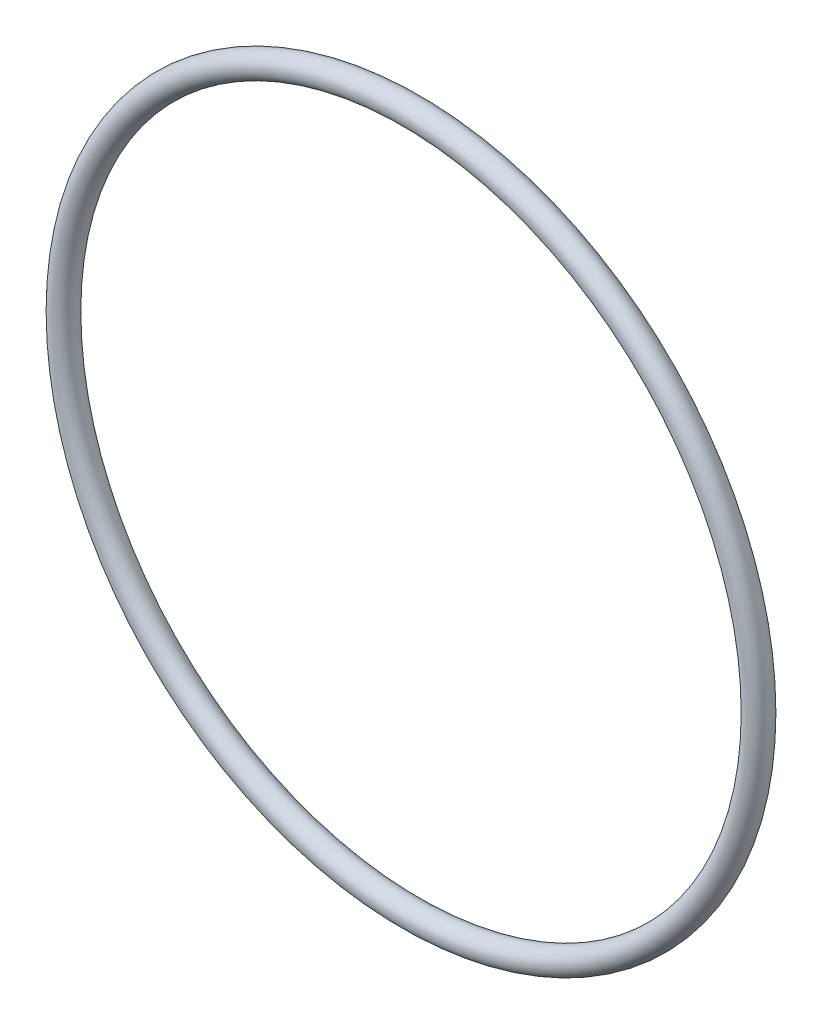
from build123d import *

# Parameters (mm, degrees)
SWEEP1_PROFILE_R = 0.8128


with BuildPart() as part:
    # Sweep1: sweep along a path in Sketch1
    with BuildLine(Plane.XY) as sweep1_path:
        CenterArc((0, 0), 23, 0, 360)
    # Sweep1 profile (on start of the path) → Sweep1 (sweep)
    with BuildSketch(Plane(origin=(23, 0, 0), x_dir=(0, 0, 1), z_dir=(0, 1, 0))):
        Circle(SWEEP1_PROFILE_R)
    sweep(path=sweep1_path.line)


solid = part.part
